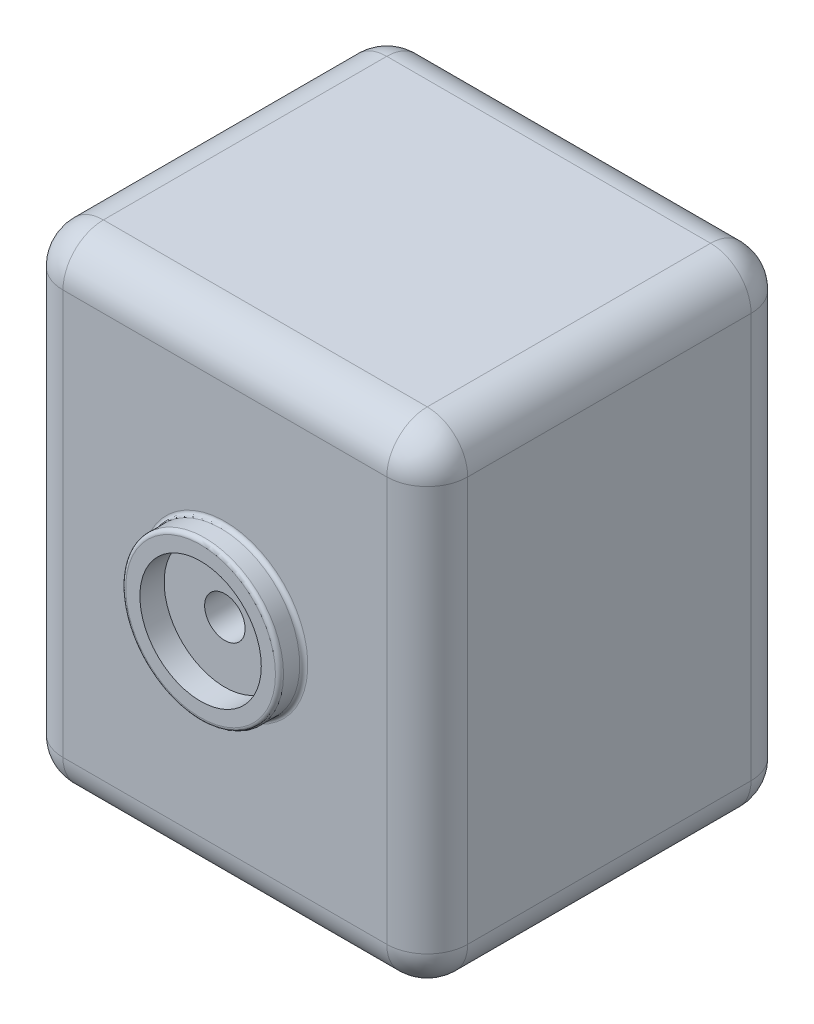
from build123d import *

# Parameters (mm, degrees)
SKETCH1_W           = 10
SKETCH1_H           = 12
BOSS_EXTRUDE1_DEPTH = 9
SKETCH3_R           = 1.95
BOSS_EXTRUDE2_DEPTH = 0.6
SKETCH5_R           = 1.5
CUT_EXTRUDE1_DEPTH  = 0.6
SKETCH7_R           = 0.5
CUT_EXTRUDE2_DEPTH  = 19.027756377
FILLET1_R           = 1
FILLET2_R           = 0.1


with BuildPart() as part:
    # Sketch1 → Boss-Extrude1 (new body)
    with BuildSketch(Plane.XY):
        with Locations((5, 6)):
            Rectangle(SKETCH1_W, SKETCH1_H)
    extrude(amount=-BOSS_EXTRUDE1_DEPTH)

    # Sketch3 → Boss-Extrude2 (add)
    with BuildSketch(Plane.XY):
        with Locations(Location((5, 6, 0), (0, 0, 180))):
            Circle(SKETCH3_R)
    extrude(amount=BOSS_EXTRUDE2_DEPTH)

    # Sketch5 → Cut-Extrude1 (cut)
    with BuildSketch(Plane.XY.offset(0.6)):
        with Locations((5, 6)):
            Circle(SKETCH5_R)
    extrude(amount=-CUT_EXTRUDE1_DEPTH, mode=Mode.SUBTRACT)

    # Sketch7 → Cut-Extrude2 (cut, through all)
    with BuildSketch(Plane.XY):
        with Locations((5, 6)):
            Circle(SKETCH7_R)
    extrude(amount=-CUT_EXTRUDE2_DEPTH, mode=Mode.SUBTRACT)

    # Fillet1
    fillet1_edges = [part.edges().sort_by_distance(p)[0] for p in [
        (10, 6, -9),
        (5, 12, -9),
        (0, 6, -9),
        (5, 12, 0),
        (10, 6, 0),
        (5, 0, 0),
        (0, 6, 0),
        (5, 0, -9),
        (0, 12, -4.5),
        (10, 12, -4.5),
        (10, 0, -4.5),
        (0, 0, -4.5),
    ]]
    fillet(fillet1_edges, radius=FILLET1_R)

    # Fillet2
    fillet2_edges = [part.edges().sort_by_distance(p)[0] for p in [
        (6.95, 6, 0),
        (6.95, 6, 0.6),
    ]]
    fillet(fillet2_edges, radius=FILLET2_R)


solid = part.part
